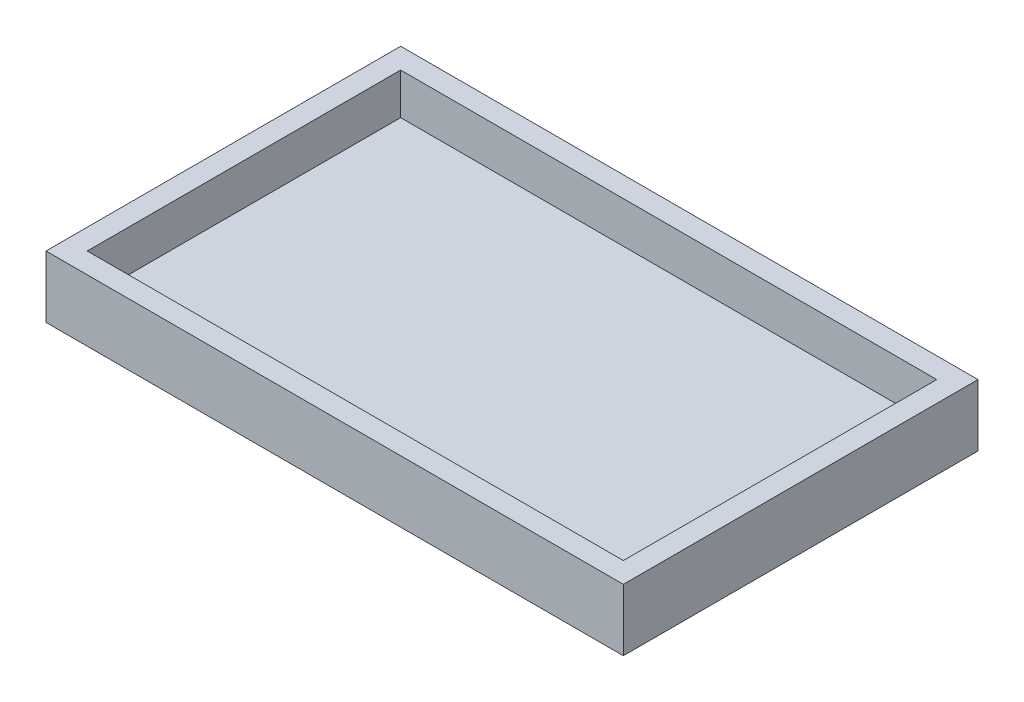
from build123d import *

# Parameters (mm, degrees)
SKETCH1_W           = 71.12
SKETCH1_H           = 43.688
SKETCH1_W_2         = 66.04
SKETCH1_H_2         = 38.608
BOSS_EXTRUDE1_DEPTH = 7.62
SKETCH1_2_W         = 66.04
SKETCH1_2_H         = 38.608
BOSS_EXTRUDE2_DEPTH = 2.54


with BuildPart() as part:
    # Sketch1 → Boss-Extrude1 (new body)
    with BuildSketch(Plane(origin=(0, 0, 0), x_dir=(1, 0, 0), z_dir=(0, 1, 0))):
        Rectangle(SKETCH1_W, SKETCH1_H)
        Rectangle(SKETCH1_W_2, SKETCH1_H_2, mode=Mode.SUBTRACT)
    extrude(amount=BOSS_EXTRUDE1_DEPTH)

    # Sketch1<2> → Boss-Extrude2 (add)
    with BuildSketch(Plane(origin=(0, 0, 0), x_dir=(1, 0, 0), z_dir=(0, 1, 0))):
        Rectangle(SKETCH1_2_W, SKETCH1_2_H)
    extrude(amount=BOSS_EXTRUDE2_DEPTH)


solid = part.part
